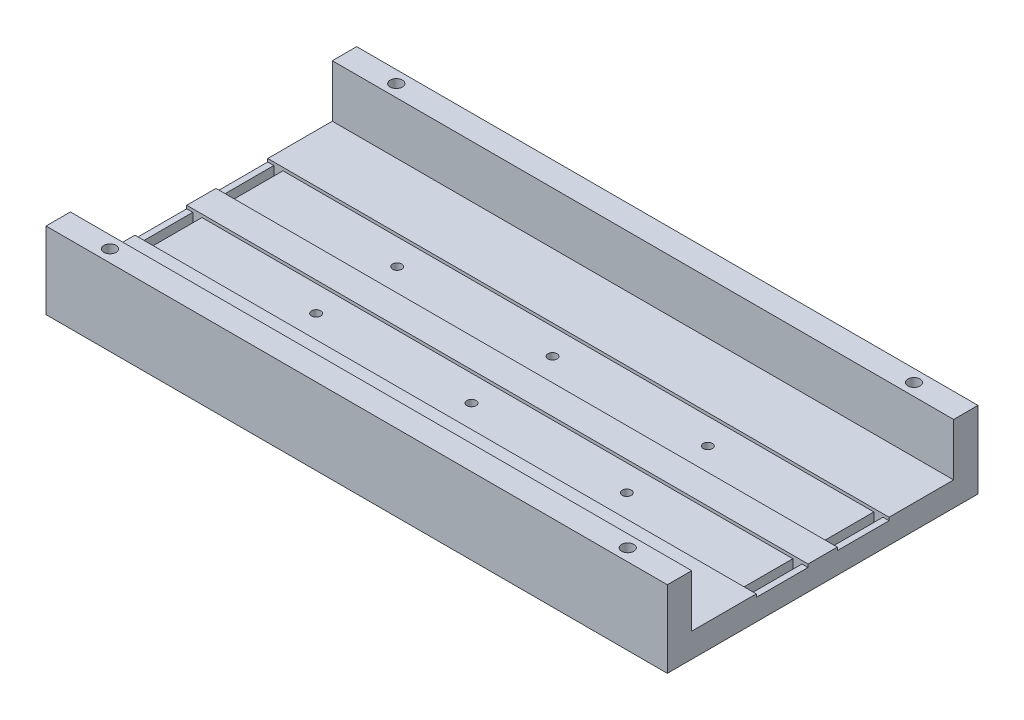
from build123d import *

# Parameters (mm, degrees)
SKETCH1_W           = 102
SKETCH1_H           = 51
BOSS_EXTRUDE2_DEPTH = 4
SKETCH2_W           = 102
SKETCH2_H           = 4
BOSS_EXTRUDE3_DEPTH = 8.6
SKETCH3_W           = 102
SKETCH3_H           = 8.5
CUT_EXTRUDE2_DEPTH  = 0.5
SKETCH4_R           = 0.75
SKETCH4_W           = 1.5
SKETCH4_H           = 8.5
CUT_EXTRUDE4_DEPTH  = 10
SKETCH6_R           = 1
CUT_EXTRUDE5_DEPTH  = 15


with BuildPart() as part:
    # Sketch1 → Boss-Extrude2 (new body)
    with BuildSketch(Plane(origin=(0, 0, 0), x_dir=(1, 0, 0), z_dir=(0, 1, 0))):
        with Locations((51, 25.5)):
            Rectangle(SKETCH1_W, SKETCH1_H)
    extrude(amount=BOSS_EXTRUDE2_DEPTH)

    # Sketch2 → Boss-Extrude3 (add)
    with BuildSketch(Plane(origin=(0, 4, 0), x_dir=(1, 0, 0), z_dir=(0, 1, 0))):
        with Locations((51, 49)):
            Rectangle(SKETCH2_W, SKETCH2_H)
        with Locations((51, 2)):
            Rectangle(SKETCH2_W, SKETCH2_H)
    extrude(amount=BOSS_EXTRUDE3_DEPTH)

    # Sketch3 → Cut-Extrude2 (cut)
    with BuildSketch(Plane(origin=(0, 4, 0), x_dir=(1, 0, 0), z_dir=(0, 1, 0))):
        with Locations((51, 18.85)):
            Rectangle(SKETCH3_W, SKETCH3_H)
        with Locations((51, 32.15)):
            Rectangle(SKETCH3_W, SKETCH3_H)
    extrude(amount=-CUT_EXTRUDE2_DEPTH, mode=Mode.SUBTRACT)

    # Sketch4 → Cut-Extrude4 (cut)
    with BuildSketch(Plane(origin=(0, 3.5, 0), x_dir=(1, 0, 0), z_dir=(0, 1, 0))):
        with Locations(Location((51, 18.85, 0), (0, 0, 270))):
            Circle(SKETCH4_R)
        with Locations(Location((76.5, 18.85, 0), (0, 0, 270))):
            Circle(SKETCH4_R)
        with Locations(Location((25.5, 18.85, 0), (0, 0, 270))):
            Circle(SKETCH4_R)
        with Locations(Location((76.5, 32.15, 0), (0, 0, 270))):
            Circle(SKETCH4_R)
        with Locations(Location((51, 32.15, 0), (0, 0, 270))):
            Circle(SKETCH4_R)
        with Locations(Location((25.5, 32.15, 0), (0, 0, 270))):
            Circle(SKETCH4_R)
        with Locations((100.25, 18.85)):
            Rectangle(SKETCH4_W, SKETCH4_H)
        with Locations((100.25, 32.15)):
            Rectangle(SKETCH4_W, SKETCH4_H)
        with Locations((1.75, 18.85)):
            Rectangle(SKETCH4_W, SKETCH4_H)
        with Locations((1.75, 32.15)):
            Rectangle(SKETCH4_W, SKETCH4_H)
    extrude(amount=-CUT_EXTRUDE4_DEPTH, mode=Mode.SUBTRACT)

    # Sketch6 → Cut-Extrude5 (cut)
    with BuildSketch(Plane(origin=(0, 12.6, 0), x_dir=(1, 0, 0), z_dir=(0, 1, 0))):
        with Locations(Location((93.5, 2, 0), (0, 0, 270))):
            Circle(SKETCH6_R)
        with Locations(Location((8.5, 2, 0), (0, 0, 270))):
            Circle(SKETCH6_R)
        with Locations(Location((93.5, 49, 0), (0, 0, 270))):
            Circle(SKETCH6_R)
        with Locations(Location((8.5, 49, 0), (0, 0, 270))):
            Circle(SKETCH6_R)
    extrude(amount=-CUT_EXTRUDE5_DEPTH, mode=Mode.SUBTRACT)


solid = part.part
